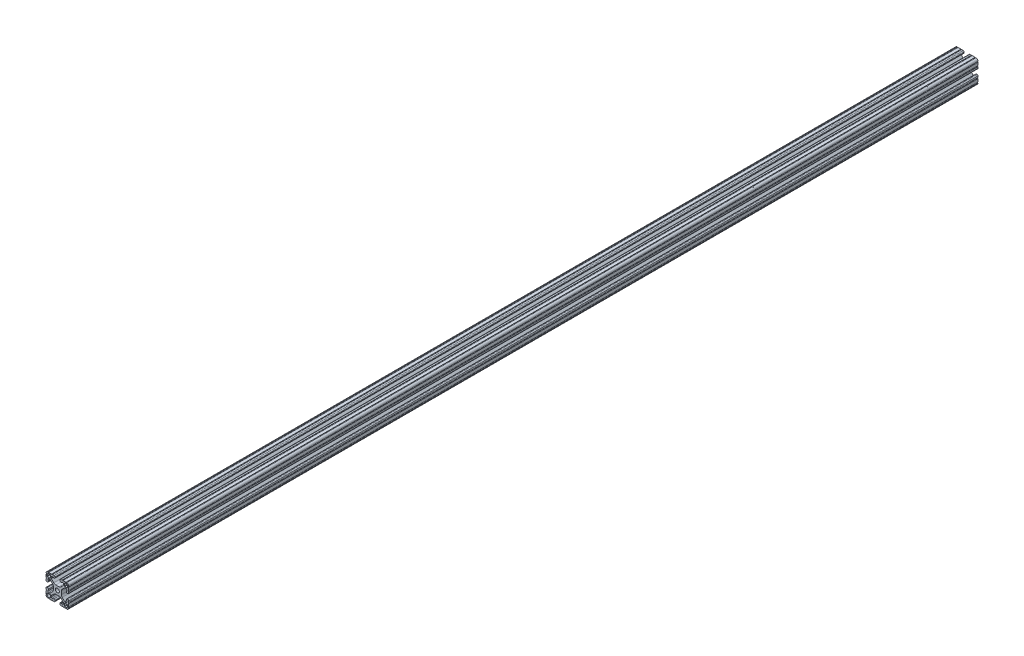
from build123d import *

# Parameters (mm, degrees)
SKETCH1_R      = 3.3274
EXTRUDE1_DEPTH = 1524


with BuildPart() as part:
    # Sketch1 → Extrude1 (new body)
    with BuildSketch(Plane.XY):
        with BuildLine():
            Line((10.02670034, -12.151875049), (6.021451835, -8.147301292))
            ThreePointArc((6.021451835, -8.147301292), (4.48060392, -7.11788044), (2.663118988, -6.7564))
            Line((2.663118988, -6.7564), (-2.663118988, -6.7564))
            ThreePointArc((-2.663118988, -6.7564), (-4.48060392, -7.11788044), (-6.021451835, -8.147301292))
            Line((-6.021451835, -8.147301292), (-10.02670034, -12.151875049))
            ThreePointArc((-10.02670034, -12.151875049), (-10.219349756, -12.440155844), (-10.287, -12.78021916))
            Line((-10.287, -12.78021916), (-10.287, -14.55471092))
            ThreePointArc((-10.287, -14.55471092), (-9.915025612, -15.452736532), (-9.017, -15.82471092))
            Line((-9.017, -15.82471092), (-6.814144259, -15.82471092))
            Line((-6.814144259, -15.82471092), (-6.814144259, -14.986))
            Line((-6.814144259, -14.986), (-5.6388, -14.986))
            ThreePointArc((-5.6388, -14.986), (-4.525248241, -15.447248241), (-4.064, -16.5608))
            Line((-4.064, -16.5608), (-4.064, -17.4752))
            ThreePointArc((-4.064, -17.4752), (-4.525248241, -18.588751759), (-5.6388, -19.05))
            Line((-5.6388, -19.05), (-7.9756, -19.05))
            ThreePointArc((-7.9756, -19.05), (-8.7376, -18.288), (-9.4996, -19.05))
            Line((-9.4996, -19.05), (-14.3256, -19.05))
            ThreePointArc((-14.3256, -19.05), (-15.0876, -18.288), (-15.8496, -19.05))
            Line((-15.8496, -19.05), (-15.875, -19.05))
            ThreePointArc((-15.875, -19.05), (-18.12006403, -18.12006403), (-19.05, -15.875))
            Line((-19.05, -15.875), (-19.05, -15.8496))
            ThreePointArc((-19.05, -15.8496), (-18.288, -15.0876), (-19.05, -14.3256))
            Line((-19.05, -14.3256), (-19.05, -9.4996))
            ThreePointArc((-19.05, -9.4996), (-18.288, -8.7376), (-19.05, -7.9756))
            Line((-19.05, -7.9756), (-19.05, -5.6388))
            ThreePointArc((-19.05, -5.6388), (-18.588751759, -4.525248241), (-17.4752, -4.064))
            Line((-17.4752, -4.064), (-16.5608, -4.064))
            ThreePointArc((-16.5608, -4.064), (-15.447248241, -4.525248241), (-14.986, -5.6388))
            Line((-14.986, -5.6388), (-14.986, -6.750644259))
            Line((-14.986, -6.750644259), (-15.879033733, -6.750644259))
            Line((-15.879033733, -6.750644259), (-15.879033733, -8.919211783))
            ThreePointArc((-15.879033733, -8.919211783), (-15.507059345, -9.817237395), (-14.609033733, -10.189211783))
            Line((-14.609033733, -10.189211783), (-12.742784468, -10.189211783))
            ThreePointArc((-12.742784468, -10.189211783), (-12.402613491, -10.121555016), (-12.114219497, -9.928882664))
            Line((-12.114219497, -9.928882664), (-8.147867153, -5.963198517))
            ThreePointArc((-8.147867153, -5.963198517), (-7.118033561, -4.422154408), (-6.7564, -2.604299809))
            Line((-6.7564, -2.604299809), (-6.7564, 2.604299809))
            ThreePointArc((-6.7564, 2.604299809), (-7.118033561, 4.422154408), (-8.147867153, 5.963198517))
            Line((-8.147867153, 5.963198517), (-12.114219497, 9.928882664))
            ThreePointArc((-12.114219497, 9.928882664), (-12.402613491, 10.121555016), (-12.742784468, 10.189211783))
            Line((-12.742784468, 10.189211783), (-14.609033733, 10.189211783))
            ThreePointArc((-14.609033733, 10.189211783), (-15.507059345, 9.817237395), (-15.879033733, 8.919211783))
            Line((-15.879033733, 8.919211783), (-15.879033733, 6.750644259))
            Line((-15.879033733, 6.750644259), (-14.986, 6.750644259))
            Line((-14.986, 6.750644259), (-14.986, 5.6388))
            ThreePointArc((-14.986, 5.6388), (-15.447248241, 4.525248241), (-16.5608, 4.064))
            Line((-16.5608, 4.064), (-17.4752, 4.064))
            ThreePointArc((-17.4752, 4.064), (-18.588751759, 4.525248241), (-19.05, 5.6388))
            Line((-19.05, 5.6388), (-19.05, 7.9756))
            ThreePointArc((-19.05, 7.9756), (-18.288, 8.7376), (-19.05, 9.4996))
            Line((-19.05, 9.4996), (-19.05, 14.3256))
            ThreePointArc((-19.05, 14.3256), (-18.288, 15.0876), (-19.05, 15.8496))
            Line((-19.05, 15.8496), (-19.05, 15.875))
            ThreePointArc((-19.05, 15.875), (-18.12006403, 18.12006403), (-15.875, 19.05))
            Line((-15.875, 19.05), (-15.8496, 19.05))
            ThreePointArc((-15.8496, 19.05), (-15.0876, 18.288), (-14.3256, 19.05))
            Line((-14.3256, 19.05), (-9.4996, 19.05))
            ThreePointArc((-9.4996, 19.05), (-8.7376, 18.288), (-7.9756, 19.05))
            Line((-7.9756, 19.05), (-5.6388, 19.05))
            ThreePointArc((-5.6388, 19.05), (-4.525248241, 18.588751759), (-4.064, 17.4752))
            Line((-4.064, 17.4752), (-4.064, 16.5608))
            ThreePointArc((-4.064, 16.5608), (-4.525248241, 15.447248241), (-5.6388, 14.986))
            Line((-5.6388, 14.986), (-6.814144259, 14.986))
            Line((-6.814144259, 14.986), (-6.814144259, 15.82471092))
            Line((-6.814144259, 15.82471092), (-9.017, 15.82471092))
            ThreePointArc((-9.017, 15.82471092), (-9.915025612, 15.452736532), (-10.287, 14.55471092))
            Line((-10.287, 14.55471092), (-10.287, 12.78021916))
            ThreePointArc((-10.287, 12.78021916), (-10.219349756, 12.440155844), (-10.02670034, 12.151875049))
            Line((-10.02670034, 12.151875049), (-6.021451835, 8.147301292))
            ThreePointArc((-6.021451835, 8.147301292), (-4.48060392, 7.11788044), (-2.663118988, 6.7564))
            Line((-2.663118988, 6.7564), (2.663118988, 6.7564))
            ThreePointArc((2.663118988, 6.7564), (4.48060392, 7.11788044), (6.021451835, 8.147301292))
            Line((6.021451835, 8.147301292), (10.02670034, 12.151875049))
            ThreePointArc((10.02670034, 12.151875049), (10.219349756, 12.440155844), (10.287, 12.78021916))
            Line((10.287, 12.78021916), (10.287, 14.55471092))
            ThreePointArc((10.287, 14.55471092), (9.915025612, 15.452736532), (9.017, 15.82471092))
            Line((9.017, 15.82471092), (6.814144259, 15.82471092))
            Line((6.814144259, 15.82471092), (6.814144259, 14.986))
            Line((6.814144259, 14.986), (5.6388, 14.986))
            ThreePointArc((5.6388, 14.986), (4.525248241, 15.447248241), (4.064, 16.5608))
            Line((4.064, 16.5608), (4.064, 17.4752))
            ThreePointArc((4.064, 17.4752), (4.525248241, 18.588751759), (5.6388, 19.05))
            Line((5.6388, 19.05), (7.9756, 19.05))
            ThreePointArc((7.9756, 19.05), (8.7376, 18.288), (9.4996, 19.05))
            Line((9.4996, 19.05), (14.3256, 19.05))
            ThreePointArc((14.3256, 19.05), (15.0876, 18.288), (15.8496, 19.05))
            Line((15.8496, 19.05), (15.875, 19.05))
            ThreePointArc((15.875, 19.05), (18.12006403, 18.12006403), (19.05, 15.875))
            Line((19.05, 15.875), (19.05, 15.8496))
            ThreePointArc((19.05, 15.8496), (18.288, 15.0876), (19.05, 14.3256))
            Line((19.05, 14.3256), (19.05, 9.4996))
            ThreePointArc((19.05, 9.4996), (18.288, 8.7376), (19.05, 7.9756))
            Line((19.05, 7.9756), (19.05, 5.6388))
            ThreePointArc((19.05, 5.6388), (18.588751759, 4.525248241), (17.4752, 4.064))
            Line((17.4752, 4.064), (16.5608, 4.064))
            ThreePointArc((16.5608, 4.064), (15.447248241, 4.525248241), (14.986, 5.6388))
            Line((14.986, 5.6388), (14.986, 6.750644259))
            Line((14.986, 6.750644259), (15.879033733, 6.750644259))
            Line((15.879033733, 6.750644259), (15.879033733, 8.919211783))
            ThreePointArc((15.879033733, 8.919211783), (15.507059345, 9.817237395), (14.609033733, 10.189211783))
            Line((14.609033733, 10.189211783), (12.742784468, 10.189211783))
            ThreePointArc((12.742784468, 10.189211783), (12.402613491, 10.121555016), (12.114219497, 9.928882664))
            Line((12.114219497, 9.928882664), (8.147867153, 5.963198517))
            ThreePointArc((8.147867153, 5.963198517), (7.118033561, 4.422154408), (6.7564, 2.604299809))
            Line((6.7564, 2.604299809), (6.7564, -2.604299809))
            ThreePointArc((6.7564, -2.604299809), (7.118033561, -4.422154408), (8.147867153, -5.963198517))
            Line((8.147867153, -5.963198517), (12.114219497, -9.928882664))
            ThreePointArc((12.114219497, -9.928882664), (12.402613491, -10.121555016), (12.742784468, -10.189211783))
            Line((12.742784468, -10.189211783), (14.609033733, -10.189211783))
            ThreePointArc((14.609033733, -10.189211783), (15.507059345, -9.817237395), (15.879033733, -8.919211783))
            Line((15.879033733, -8.919211783), (15.879033733, -6.750644259))
            Line((15.879033733, -6.750644259), (14.986, -6.750644259))
            Line((14.986, -6.750644259), (14.986, -5.6388))
            ThreePointArc((14.986, -5.6388), (15.447248241, -4.525248241), (16.5608, -4.064))
            Line((16.5608, -4.064), (17.4752, -4.064))
            ThreePointArc((17.4752, -4.064), (18.588751759, -4.525248241), (19.05, -5.6388))
            Line((19.05, -5.6388), (19.05, -7.9756))
            ThreePointArc((19.05, -7.9756), (18.288, -8.7376), (19.05, -9.4996))
            Line((19.05, -9.4996), (19.05, -14.3256))
            ThreePointArc((19.05, -14.3256), (18.288, -15.0876), (19.05, -15.8496))
            Line((19.05, -15.8496), (19.05, -15.875))
            ThreePointArc((19.05, -15.875), (18.12006403, -18.12006403), (15.875, -19.05))
            Line((15.875, -19.05), (15.8496, -19.05))
            ThreePointArc((15.8496, -19.05), (15.0876, -18.288), (14.3256, -19.05))
            Line((14.3256, -19.05), (9.4996, -19.05))
            ThreePointArc((9.4996, -19.05), (8.7376, -18.288), (7.9756, -19.05))
            Line((7.9756, -19.05), (5.6388, -19.05))
            ThreePointArc((5.6388, -19.05), (4.525248241, -18.588751759), (4.064, -17.4752))
            Line((4.064, -17.4752), (4.064, -16.5608))
            ThreePointArc((4.064, -16.5608), (4.525248241, -15.447248241), (5.6388, -14.986))
            Line((5.6388, -14.986), (6.814144259, -14.986))
            Line((6.814144259, -14.986), (6.814144259, -15.82471092))
            Line((6.814144259, -15.82471092), (9.017, -15.82471092))
            ThreePointArc((9.017, -15.82471092), (9.915025612, -15.452736532), (10.287, -14.55471092))
            Line((10.287, -14.55471092), (10.287, -12.78021916))
            ThreePointArc((10.287, -12.78021916), (10.219349756, -12.440155844), (10.02670034, -12.151875049))
        make_face()
        Circle(SKETCH1_R, mode=Mode.SUBTRACT)
        with BuildLine():
            Line((16.891, -11.8618), (12.2428, -11.8618))
            ThreePointArc((12.2428, -11.8618), (11.973392316, -11.973392316), (11.8618, -12.2428))
            Line((11.8618, -12.2428), (11.8618, -16.891))
            ThreePointArc((11.8618, -16.891), (11.973392316, -17.160407684), (12.2428, -17.272))
            Line((12.2428, -17.272), (14.478, -17.272))
            ThreePointArc((14.478, -17.272), (16.453656347, -16.453656347), (17.272, -14.478))
            Line((17.272, -14.478), (17.272, -12.2428))
            ThreePointArc((17.272, -12.2428), (17.160407684, -11.973392316), (16.891, -11.8618))
        make_face(mode=Mode.SUBTRACT)
        with BuildLine():
            Line((17.272, 14.478), (17.272, 12.2428))
            ThreePointArc((17.272, 12.2428), (17.160407684, 11.973392316), (16.891, 11.8618))
            Line((16.891, 11.8618), (12.2428, 11.8618))
            ThreePointArc((12.2428, 11.8618), (11.973392316, 11.973392316), (11.8618, 12.2428))
            Line((11.8618, 12.2428), (11.8618, 16.891))
            ThreePointArc((11.8618, 16.891), (11.973392316, 17.160407684), (12.2428, 17.272))
            Line((12.2428, 17.272), (14.478, 17.272))
            ThreePointArc((14.478, 17.272), (16.453656347, 16.453656347), (17.272, 14.478))
        make_face(mode=Mode.SUBTRACT)
        with BuildLine():
            Line((-17.272, -14.478), (-17.272, -12.2428))
            ThreePointArc((-17.272, -12.2428), (-17.160407684, -11.973392316), (-16.891, -11.8618))
            Line((-16.891, -11.8618), (-12.2428, -11.8618))
            ThreePointArc((-12.2428, -11.8618), (-11.973392316, -11.973392316), (-11.8618, -12.2428))
            Line((-11.8618, -12.2428), (-11.8618, -16.891))
            ThreePointArc((-11.8618, -16.891), (-11.973392316, -17.160407684), (-12.2428, -17.272))
            Line((-12.2428, -17.272), (-14.478, -17.272))
            ThreePointArc((-14.478, -17.272), (-16.453656347, -16.453656347), (-17.272, -14.478))
        make_face(mode=Mode.SUBTRACT)
        with BuildLine():
            Line((-16.891, 11.8618), (-12.2428, 11.8618))
            ThreePointArc((-12.2428, 11.8618), (-11.973392316, 11.973392316), (-11.8618, 12.2428))
            Line((-11.8618, 12.2428), (-11.8618, 16.891))
            ThreePointArc((-11.8618, 16.891), (-11.973392316, 17.160407684), (-12.2428, 17.272))
            Line((-12.2428, 17.272), (-14.478, 17.272))
            ThreePointArc((-14.478, 17.272), (-16.453656347, 16.453656347), (-17.272, 14.478))
            Line((-17.272, 14.478), (-17.272, 12.2428))
            ThreePointArc((-17.272, 12.2428), (-17.160407684, 11.973392316), (-16.891, 11.8618))
        make_face(mode=Mode.SUBTRACT)
    extrude(amount=-EXTRUDE1_DEPTH)


solid = part.part
